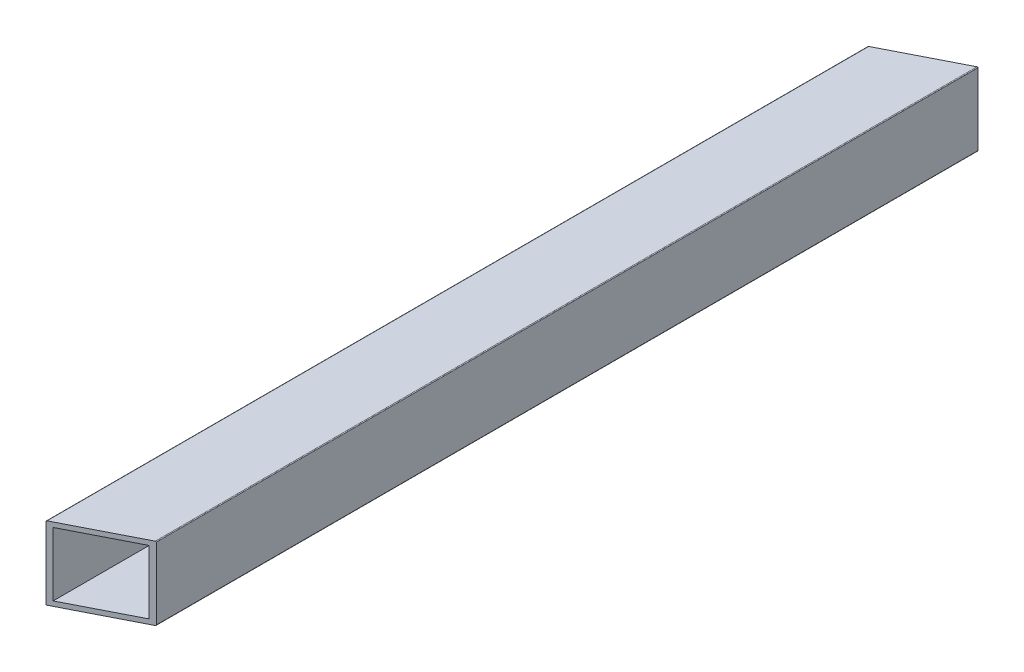
from build123d import *

# Parameters (mm, degrees)
SKETCH1_W           = 25.4
SKETCH1_H           = 25.4
BOSS_EXTRUDE1_DEPTH = 149.225
FILLET1_R           = 0.254
CUT_EXTRUDE1_DEPTH  = 38.1
SKETCH4_W           = 22.098
SKETCH4_H           = 22.098
CUT_EXTRUDE4_DEPTH  = 685.8
CUT_EXTRUDE5_DEPTH  = 685.8


with BuildPart() as part:
    # Sketch1 → Boss-Extrude1 (new, symmetric)
    with BuildSketch(Plane.XY):
        Rectangle(SKETCH1_W, SKETCH1_H)
    extrude(amount=BOSS_EXTRUDE1_DEPTH, both=True)

    # Fillet1
    fillet1_edges = [part.edges().sort_by_distance(p)[0] for p in [
        (-12.7, 12.7, 0),
        (-12.7, -12.7, 0),
        (12.7, -12.7, 0),
        (12.7, 12.7, 0),
    ]]
    fillet(fillet1_edges, radius=FILLET1_R)

    # Sketch2 → Cut-Extrude1 (cut)
    with BuildSketch(Plane.XZ.offset(12.7)):
        Polygon((-12.7, 149.225), (12.7, 136.283053583), (12.7, 149.225), align=None)
    extrude(amount=-CUT_EXTRUDE1_DEPTH, mode=Mode.SUBTRACT)

    # Sketch4 → Cut-Extrude4 (cut)
    with BuildSketch(Plane(origin=(0, 0, -149.225), x_dir=(-1, 0, 0), z_dir=(0, 0, -1))):
        Rectangle(SKETCH4_W, SKETCH4_H)
    extrude(amount=-CUT_EXTRUDE4_DEPTH, mode=Mode.SUBTRACT)

    # Sketch5 → Cut-Extrude5 (cut)
    with BuildSketch(Plane.XZ.offset(12.7)):
        Polygon((-12.7, -136.283053583), (-12.7, -149.225), (12.7, -149.225), align=None)
    extrude(amount=-CUT_EXTRUDE5_DEPTH, mode=Mode.SUBTRACT)


solid = part.part
